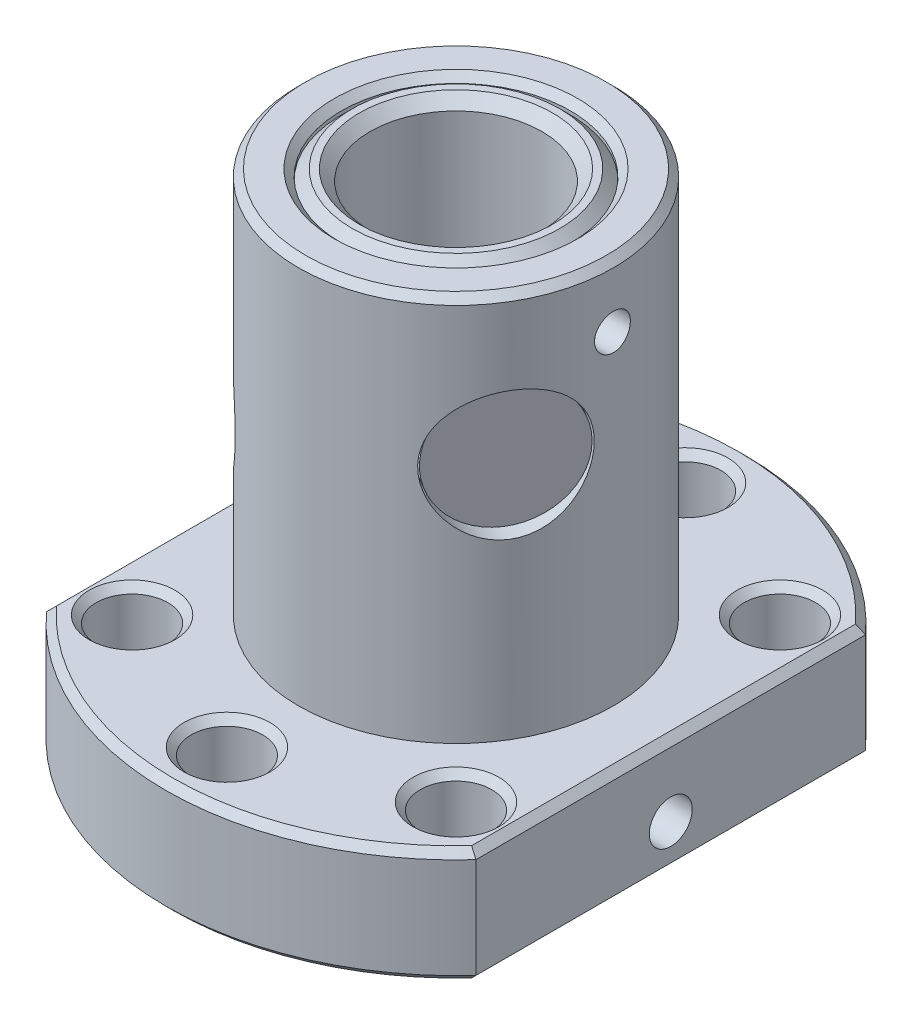
from build123d import *

# Parameters (mm, degrees)
BOSS_EXTRUDE1_DEPTH                 = 8
SKETCH2_R                           = 11
BOSS_EXTRUDE2_DEPTH                 = 27
F_16_0MM_DOWEL_HOLE1_D              = 16
F_5_0MM_DOWEL_HOLE1_D               = 5
F_3_0MM_DOWEL_HOLE1_D               = 3
M5_TAPPED_HOLE1_REACH               = 56.178
M5_TAPPED_HOLE1_BORE_R              = 2.1
F_8_0MM_DOWEL_HOLE1_REACH           = 42.666
F_8_0MM_DOWEL_HOLE1_BORE_R          = 4.5
F_8_0MM_DOWEL_HOLE1_ON_FACE_2_REACH = 45.289
F_8_0MM_DOWEL_HOLE1_BORE_2_R        = 4.5
F_8_0MM_DOWEL_HOLE1_ON_FACE_3_REACH = 42.423
F_8_0MM_DOWEL_HOLE1_BORE_3_R        = 4.5
M3_TAPPED_HOLE1_D                   = 2.5
SKETCH20_R                          = 8
SKETCH20_R_2                        = 6
BOSS_EXTRUDE3_DEPTH                 = 35
CHAMFER1_SIZE                       = 0.5
CHAMFER2_SIZE                       = 0.75
SKETCH21_R                          = 4.4
BOSS_EXTRUDE4_DEPTH                 = 2
SKETCH22_R                          = 4.4
BOSS_EXTRUDE5_DEPTH                 = 2
SKETCH23_R                          = 4.4
BOSS_EXTRUDE6_DEPTH                 = 2


with BuildPart() as part:
    # Sketch1 → Boss-Extrude1 (new body)
    with BuildSketch(Plane(origin=(0, 0, 0), x_dir=(1, 0, 0), z_dir=(0, 1, 0))):
        with BuildLine():
            Line((-15, 13.60376786), (-15, -13.60376786))
            ThreePointArc((-15, -13.60376786), (0, -20.25), (15, -13.60376786))
            Line((15, -13.60376786), (15, 13.60376786))
            ThreePointArc((15, 13.60376786), (0, 20.25), (-15, 13.60376786))
        make_face()
    extrude(amount=BOSS_EXTRUDE1_DEPTH)

    # Sketch2 → Boss-Extrude2 (add)
    with BuildSketch(Plane(origin=(0, 8, 0), x_dir=(1, 0, 0), z_dir=(0, 1, 0))):
        with Locations(Location((0, 0, 0), (0, 0, 270))):
            Circle(SKETCH2_R)
    extrude(amount=BOSS_EXTRUDE2_DEPTH)

    # Ø16.0mm Dowel Hole1 (through all)
    with Locations(Plane(origin=(0, 0, 0), x_dir=(-1, 0, 0), z_dir=(0, -1, 0))):
        with Locations((0, 0)):
            Hole(F_16_0MM_DOWEL_HOLE1_D / 2)

    # Ø5.0mm Dowel Hole1 (through all)
    with Locations(Plane(origin=(0, 0, 0), x_dir=(-1, 0, 0), z_dir=(0, -1, 0))):
        with Locations((0, -16), (11.313708499, -11.313708499), (-11.313708499, -11.313708499), (-11.313708499, 11.313708499), (0, 16), (11.313708499, 11.313708499)):
            Hole(F_5_0MM_DOWEL_HOLE1_D / 2)

    # Ø3.0mm Dowel Hole1 (through all)
    with Locations(Plane(origin=(15, 0, 0), x_dir=(0, 0, -1), z_dir=(1, 0, 0))):
        with Locations((0, 3)):
            Hole(F_3_0MM_DOWEL_HOLE1_D / 2)

    # M5 Tapped Hole1 bore (on position points) → M5 Tapped Hole1 (cut, up to next)
    with BuildSketch(Plane(origin=(7.749092493, 5, -18.708662847), x_dir=(-0.923884585058, 0, -0.382671234211), z_dir=(0.382671234211, 0, -0.923884585058)), mode=Mode.PRIVATE) as m5_tapped_hole1_sk1:
        Circle(M5_TAPPED_HOLE1_BORE_R)
    m5_tapped_hole1_tool1 = extrude(m5_tapped_hole1_sk1.sketch, amount=-M5_TAPPED_HOLE1_REACH, mode=Mode.PRIVATE) & part.part
    add(m5_tapped_hole1_tool1.solids().sort_by_distance((7.749092, 5, -18.708663))[0], mode=Mode.SUBTRACT)

    # Ø8.0mm Dowel Hole1 bore (on position points) → Ø8.0mm Dowel Hole1 (cut, up to next)
    with BuildSketch(Plane(origin=(-9.680222986, 19.890836616, 5.224297363), x_dir=(-0.474936123914, 0, -0.880020271472), z_dir=(-0.880020271472, 0, 0.474936123914)), mode=Mode.PRIVATE) as f_8_0mm_dowel_hole1_sk1:
        Circle(F_8_0MM_DOWEL_HOLE1_BORE_R)
    f_8_0mm_dowel_hole1_tool1 = extrude(f_8_0mm_dowel_hole1_sk1.sketch, amount=-F_8_0MM_DOWEL_HOLE1_REACH, mode=Mode.PRIVATE) & part.part
    add(f_8_0mm_dowel_hole1_tool1.solids().sort_by_distance((-9.680223, 19.890837, 5.224297))[0], mode=Mode.SUBTRACT)

    # Ø8.0mm Dowel Hole1 bore 2 (on position points) → Ø8.0mm Dowel Hole1 on face 2 (cut, up to next)
    with BuildSketch(Plane(origin=(9.450832416, 24.624777027, 5.628655847), x_dir=(-0.511695813153, 0, 0.859166686273), z_dir=(0.859166686273, 0, 0.511695813153)), mode=Mode.PRIVATE) as f_8_0mm_dowel_hole1_on_face_2_sk1:
        with Locations((-1e-09, 0)):
            Circle(F_8_0MM_DOWEL_HOLE1_BORE_2_R)
    f_8_0mm_dowel_hole1_on_face_2_tool1 = extrude(f_8_0mm_dowel_hole1_on_face_2_sk1.sketch, amount=-F_8_0MM_DOWEL_HOLE1_ON_FACE_2_REACH, mode=Mode.PRIVATE) & part.part
    add(f_8_0mm_dowel_hole1_on_face_2_tool1.solids().sort_by_distance((9.450832, 24.624777, 5.628656))[0], mode=Mode.SUBTRACT)

    # Ø8.0mm Dowel Hole1 bore 3 (on position points) → Ø8.0mm Dowel Hole1 on face 3 (cut, up to next)
    with BuildSketch(Plane(origin=(1.166452239, 15, -10.937979209), x_dir=(-0.994361760993, 0, -0.106040974512), z_dir=(0.106040974512, 0, -0.994361760993)), mode=Mode.PRIVATE) as f_8_0mm_dowel_hole1_on_face_3_sk1:
        Circle(F_8_0MM_DOWEL_HOLE1_BORE_3_R)
    f_8_0mm_dowel_hole1_on_face_3_tool1 = extrude(f_8_0mm_dowel_hole1_on_face_3_sk1.sketch, amount=-F_8_0MM_DOWEL_HOLE1_ON_FACE_3_REACH, mode=Mode.PRIVATE) & part.part
    add(f_8_0mm_dowel_hole1_on_face_3_tool1.solids().sort_by_distance((1.166452, 15, -10.937979))[0], mode=Mode.SUBTRACT)

    # M3 Tapped Hole1 (through all)
    with Locations(Plane(origin=(-15, 0, 0), x_dir=(0, 0, -1), z_dir=(-1, 0, 0))):
        with Locations((0, -30.622553753)):
            Hole(M3_TAPPED_HOLE1_D / 2)

    # Chamfer1
    chamfer1_edges = [part.edges().sort_by_distance(p)[0] for p in [
        (0, 8, 20.25),
        (15, 8, 0),
        (0, 35, -11),
        (-8, 0, 0),
        (-8, 35, 0),
        (-13.813708499, 0, -11.313708499),
        (-13.813708499, 8, -11.313708499),
        (-2.5, 0, -16),
        (-2.5, 8, -16),
        (0, 8, -20.25),
        (8.813708499, 0, -11.313708499),
        (8.813708499, 8, -11.313708499),
        (15, 0, 0),
        (8.813708499, 0, 11.313708499),
        (8.813708499, 8, 11.313708499),
        (0, 0, 20.25),
        (-15, 0, 0),
        (-13.813708499, 0, 11.313708499),
        (-13.813708499, 8, 11.313708499),
        (0, 0, -20.25),
        (-2.5, 0, 16),
        (-2.5, 8, 16),
        (-15, 8, 0),
    ]]
    chamfer(chamfer1_edges, length=CHAMFER1_SIZE)



with BuildPart() as body_2:
    # Sketch20 → Boss-Extrude3 (new body)
    with BuildSketch(Plane.XZ):
        with Locations(Location((0, 0, 0), (0, 0, 270))):
            Circle(SKETCH20_R)
        with Locations(Location((0, 0, 0), (0, 0, 270))):
            Circle(SKETCH20_R_2, mode=Mode.SUBTRACT)
    extrude(amount=-BOSS_EXTRUDE3_DEPTH)

    # Chamfer2
    chamfer2_edges = [body_2.edges().sort_by_distance(p)[0] for p in [
        (0, 0, 8),
        (0, 35, 6),
        (0, 35, 8),
        (0, 0, 6),
    ]]
    chamfer(chamfer2_edges, length=CHAMFER2_SIZE)


with BuildPart() as body_3:
    # Sketch21 → Boss-Extrude4 (new body)
    with BuildSketch(Plane(origin=(0.848328901, 0, -7.95489397), x_dir=(-0.9943617462588752, 0, -0.10604111267334164), z_dir=(0.10604111267334165, 0, -0.9943617462588753))):
        with Locations((0, 15)):
            Circle(SKETCH21_R)
    extrude(amount=BOSS_EXTRUDE4_DEPTH)


with BuildPart() as part_1:
    add(part.part)

    add(body_2.part)  # Boss-Extrude5 merges body 2
    # Sketch22 → Boss-Extrude5 (add)
    with BuildSketch(Plane(origin=(-7.040162172, 0, 3.799488991), x_dir=(0.4749361239135171, 0, 0.8800202714722), z_dir=(-0.8800202714721999, 0, 0.474936123913517))):
        with Locations(Location((0, 19.890836616, 0), (0, 0, 180))):
            Circle(SKETCH22_R)
    extrude(amount=BOSS_EXTRUDE5_DEPTH)


with BuildPart() as body_3_2:
    # Sketch23 → Boss-Extrude6 (new body)
    with BuildSketch(Plane(origin=(6.873332666, 0, 4.093567888), x_dir=(0.511695986051163, 0, -0.8591665832998442), z_dir=(0.8591665832998442, 0, 0.511695986051163))):
        with Locations((0, 24.624777027)):
            Circle(SKETCH23_R)
    extrude(amount=BOSS_EXTRUDE6_DEPTH)


solid = Compound([body_3.part, part_1.part, body_3_2.part])
